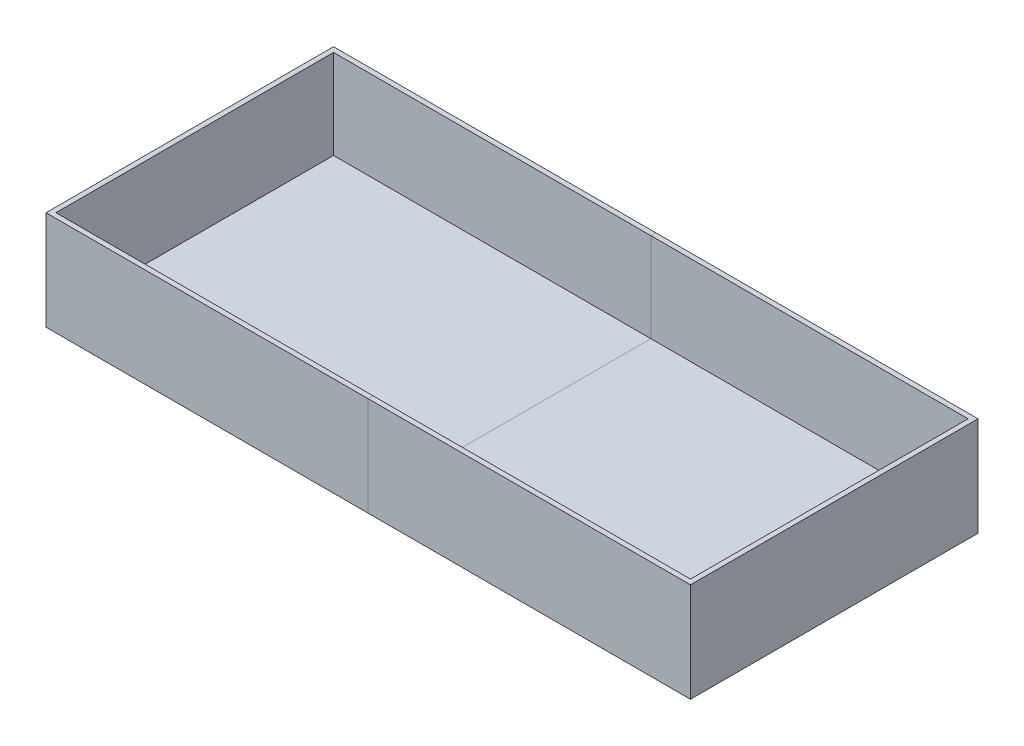
from build123d import *

# Parameters (mm, degrees)
SKETCH1_W           = 412.75
SKETCH1_H           = 184.15
SKETCH1_W_2         = 406.4
SKETCH1_H_2         = 177.8
BOSS_EXTRUDE2_DEPTH = 63.5
SKETCH2_W           = 406.4
SKETCH2_H           = 177.8
BOSS_EXTRUDE4_DEPTH = 6.35


with BuildPart() as part:
    # Sketch1 → Boss-Extrude2 (new body)
    with BuildSketch(Plane(origin=(0, 0, 0), x_dir=(1, 0, 0), z_dir=(0, 1, 0))):
        Rectangle(SKETCH1_W, SKETCH1_H)
        Rectangle(SKETCH1_W_2, SKETCH1_H_2, mode=Mode.SUBTRACT)
    extrude(amount=BOSS_EXTRUDE2_DEPTH)

    # Sketch2 → Boss-Extrude4 (add)
    with BuildSketch(Plane(origin=(0, 0, 0), x_dir=(1, 0, 0), z_dir=(0, 1, 0))):
        Rectangle(SKETCH2_W, SKETCH2_H)
    extrude(amount=BOSS_EXTRUDE4_DEPTH)


with BuildPart() as body_2:
    # Split1: the piece on the far side of the plane
    add(part.part)
    split(bisect_by=Plane.YZ, keep=Keep.BOTTOM)


with BuildPart() as part_1:
    add(part.part)

    # Split1
    split(bisect_by=Plane.YZ, keep=Keep.TOP)


solid = Compound([body_2.part, part_1.part])
